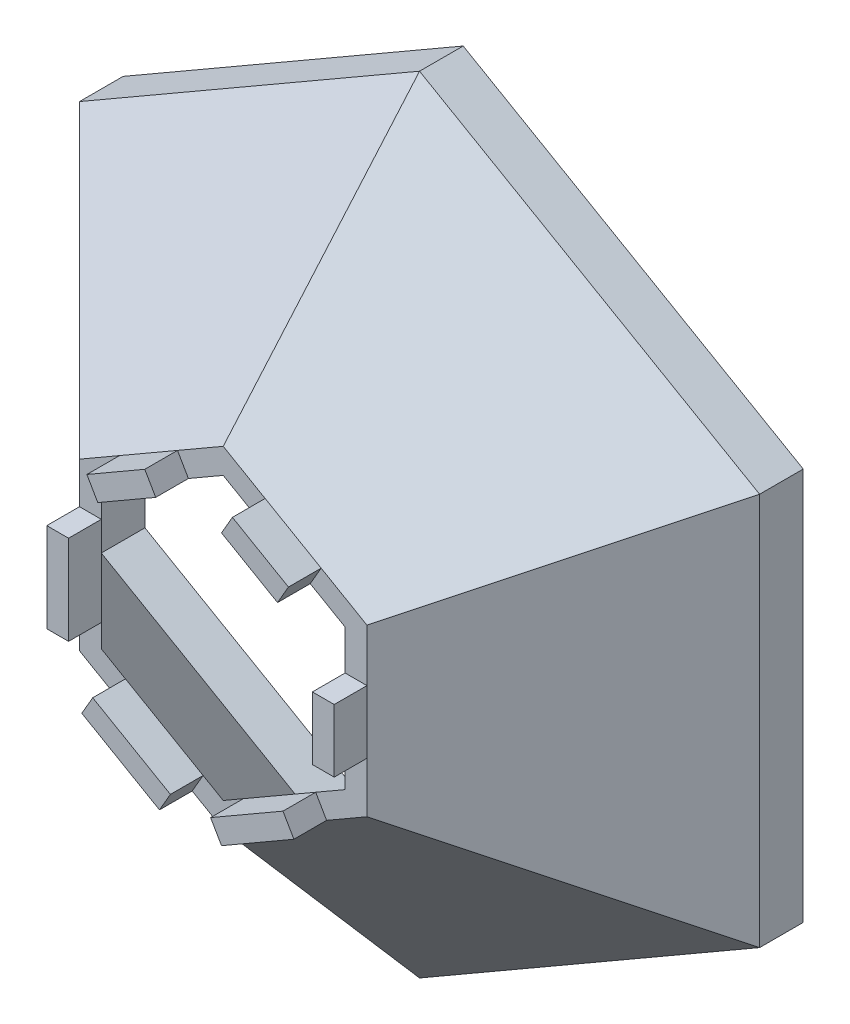
from build123d import *

# Parameters (mm, degrees)
AUFSATZ_LINEAR_AUSTRAGEN1_DEPTH = 10
AUFSATZ_LINEAR_AUSTRAGEN1_TAPER = 45
SCHNITT_LINEAR_AUSTRAGEN1_DEPTH = 10
SCHNITT_LINEAR_AUSTRAGEN1_DRAFT = -45
SKIZZE4_W                       = 18.456831932
SKIZZE4_H                       = 18.61324181
SCHNITT_LINEAR_AUSTRAGEN2_DEPTH = 1
LINEAR_AUSTRAGEN_D_NN1_DEPTH    = 2
SKIZZE6_W                       = 1
SKIZZE6_H                       = 2.884303542
SKIZZE6_H_2                     = 4.096110591
AUFSATZ_LINEAR_AUSTRAGEN2_DEPTH = 1.5


with BuildPart() as part:
    # Skizze1 → Aufsatz-Linear austragen1 (new body)
    with BuildSketch(Plane.XY):
        Polygon((0, 18), (-15.588457268, 9), (-15.588457268, -9), (0, -18), (15.588457268, -9), (15.588457268, 9), align=None)
    extrude(amount=AUFSATZ_LINEAR_AUSTRAGEN1_DEPTH, taper=AUFSATZ_LINEAR_AUSTRAGEN1_TAPER)


with BuildPart() as schnitt_linear_austragen1_tool:
    # Skizze3 → Schnitt-Linear austragen1 (with draft: the straight prism first)
    with BuildSketch(Plane(origin=(0, 0, 0), x_dir=(-1, 0, 0), z_dir=(0, 0, -1))):
        Polygon((0, -16.845299462), (14.588457268, -8.422649731), (14.588457268, 8.422649731), (0, 16.845299462), (-14.588457268, 8.422649731), (-14.588457268, -8.422649731), align=None)
    extrude(amount=-SCHNITT_LINEAR_AUSTRAGEN1_DEPTH)
    # Schnitt-Linear austragen1: the draft: its side faces are tilted about the plane it starts from
    schnitt_linear_austragen1_sides = [schnitt_linear_austragen1_tool.faces().sort_by_distance(p)[0] for p in [
        (-7.294228634, -12.633974596, 5),
        (-14.588457268, 0, 5),
        (-7.294228634, 12.633974596, 5),
        (7.294228634, 12.633974596, 5),
        (14.588457268, 0, 5),
        (7.294228634, -12.633974596, 5),
    ]]
    draft(schnitt_linear_austragen1_sides, Plane(origin=(0, 0, 0), x_dir=(-1, 0, 0), z_dir=(0, 0, -1)), SCHNITT_LINEAR_AUSTRAGEN1_DRAFT)


with BuildPart() as part_1:
    add(part.part)

    # Schnitt-Linear austragen1: cut by schnitt_linear_austragen1_tool
    add(schnitt_linear_austragen1_tool.part, mode=Mode.SUBTRACT)

    # Skizze4 → Schnitt-Linear austragen2 (cut)
    with BuildSketch(Plane.XY.offset(10)):
        with Locations((-0.579719129, -0.066676412)):
            Rectangle(SKIZZE4_W, SKIZZE4_H)
    extrude(amount=-SCHNITT_LINEAR_AUSTRAGEN2_DEPTH, mode=Mode.SUBTRACT)

    # Skizze5 → Linear-Austragen-Dünn1 (add)
    with BuildSketch(Plane(origin=(0, 0, 0), x_dir=(-1, 0, 0), z_dir=(0, 0, -1))):
        Polygon((0, 18), (-15.588457268, 9), (-15.588457268, -9), (0, -18), (15.588457268, -9), (15.588457268, 9), align=None)
        Polygon((0, 16.845299462), (-14.588457268, 8.422649731), (-14.588457268, -8.422649731), (0, -16.845299462), (14.588457268, -8.422649731), (14.588457268, 8.422649731), align=None, mode=Mode.SUBTRACT)
    extrude(amount=LINEAR_AUSTRAGEN_D_NN1_DEPTH)

    # Skizze6 → Aufsatz-Linear austragen2 (add)
    with BuildSketch(Plane.XY.offset(9)):
        Polygon((-4.749990863, 4.865286651), (-4.249990863, 3.999261247), (-1.59539386, 5.531893541), (-2.09539386, 6.397918945), align=None)
        Polygon((1.921657415, 6.498225729), (1.421657415, 5.632200325), (3.989719656, 4.149528899), (4.489719656, 5.015554303), align=None)
        with Locations((6.088457268, -0.039837206)):
            Rectangle(SKIZZE6_W, SKIZZE6_H)
        Polygon((4.739719656, -4.871216735), (4.239719656, -4.005191332), (0.921657415, -5.92087546), (1.421657415, -6.786900863), align=None)
        Polygon((-1.421657415, -6.786900863), (-0.921657415, -5.92087546), (-4.48199319, -3.865314642), (-4.98199319, -4.731340045), align=None)
        with Locations((-6.088457268, -0.132397801)):
            Rectangle(SKIZZE6_W, SKIZZE6_H_2)
    extrude(amount=AUFSATZ_LINEAR_AUSTRAGEN2_DEPTH)


solid = part_1.part
